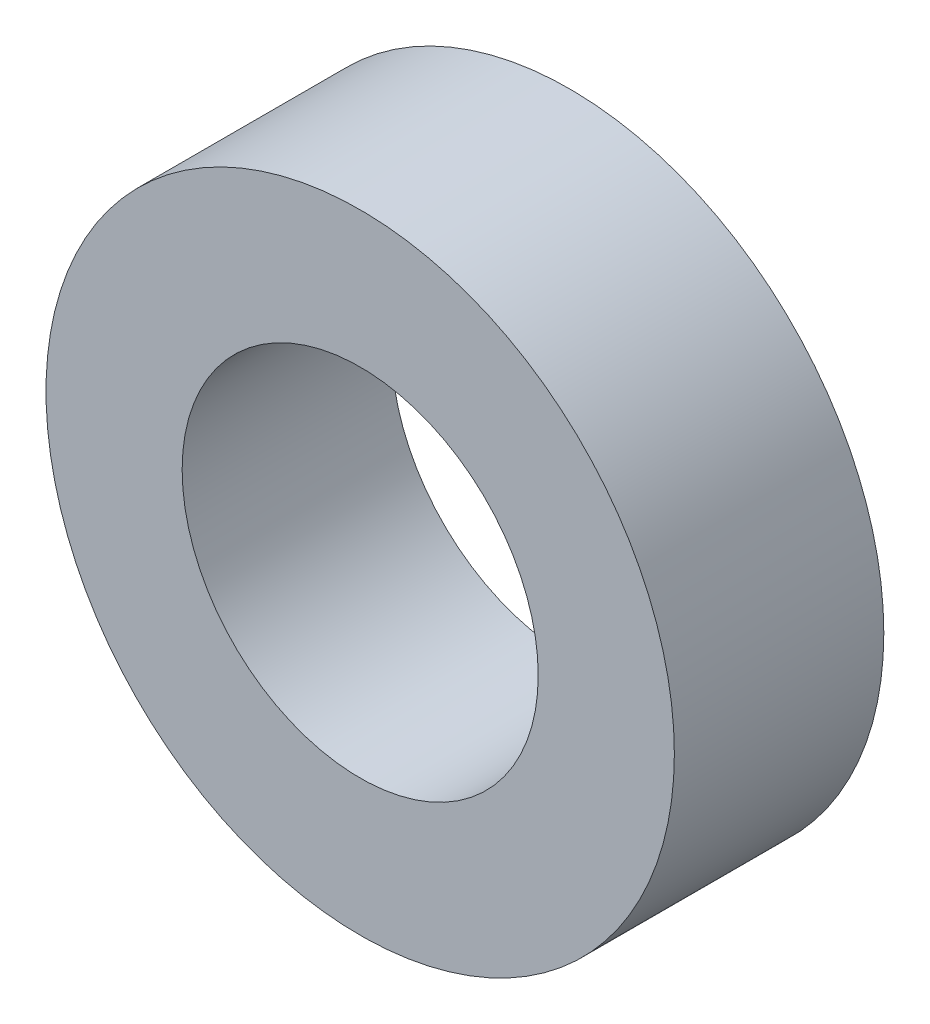
from build123d import *

# Parameters (mm, degrees)
MAIN_PROFILE_SKETCH_R   = 3
MAIN_PROFILE_SKETCH_R_2 = 1.7
MAIN_EXTRUSION_DEPTH    = 2


with BuildPart() as part:
    # Main Profile Sketch → Main Extrusion (new body)
    with BuildSketch(Plane.XY.offset(71)):
        with Locations((-147, 33)):
            Circle(MAIN_PROFILE_SKETCH_R)
        with Locations((-147, 33)):
            Circle(MAIN_PROFILE_SKETCH_R_2, mode=Mode.SUBTRACT)
    extrude(amount=-MAIN_EXTRUSION_DEPTH)


solid = part.part
